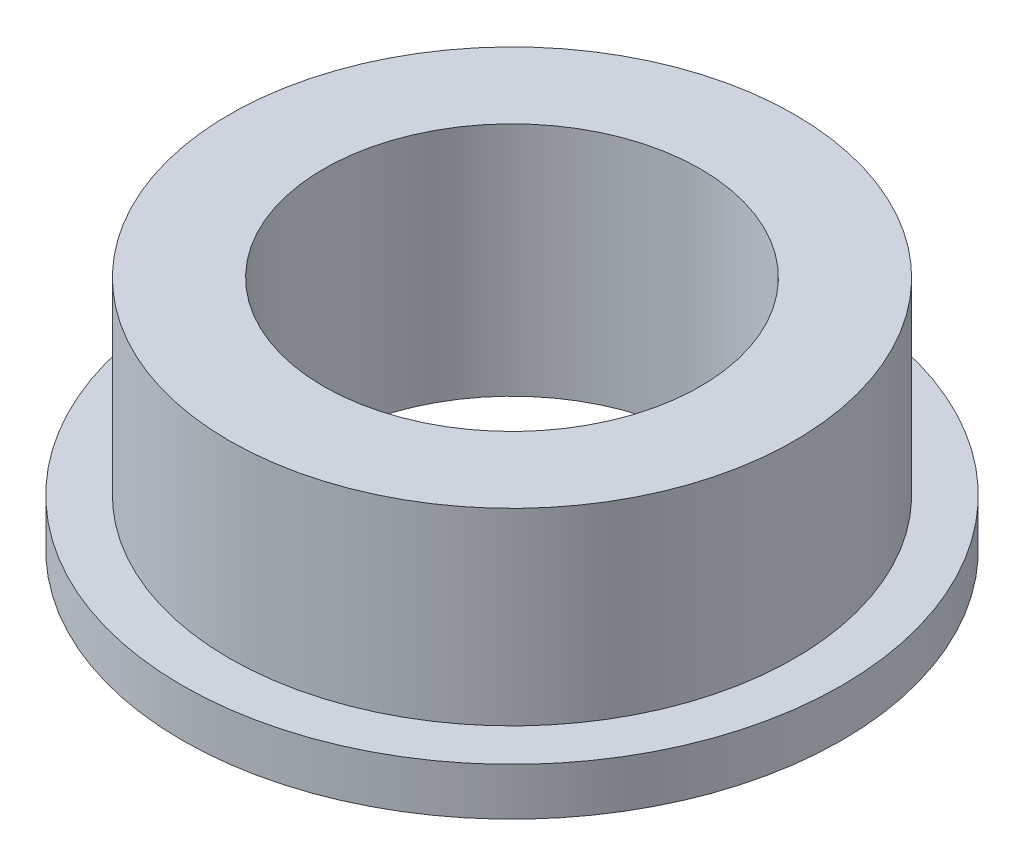
from build123d import *

# Parameters (mm, degrees)
SKETCH1_R           = 11.1125
SKETCH1_R_2         = 6.35
BOSS_EXTRUDE1_DEPTH = 1.6002
SKETCH2_R           = 9.525
SKETCH2_R_2         = 6.35
BOSS_EXTRUDE2_DEPTH = 6.35


with BuildPart() as part:
    # Sketch1 → Boss-Extrude1 (new body)
    with BuildSketch(Plane(origin=(0, 0, 0), x_dir=(1, 0, 0), z_dir=(0, 1, 0))):
        with Locations(Location((0, 0, 0), (0, 0, 270))):
            Circle(SKETCH1_R)
        with Locations(Location((0, 0, 0), (0, 0, 270))):
            Circle(SKETCH1_R_2, mode=Mode.SUBTRACT)
    extrude(amount=BOSS_EXTRUDE1_DEPTH)

    # Sketch2 → Boss-Extrude2 (add)
    with BuildSketch(Plane(origin=(0, 1.6002, 0), x_dir=(1, 0, 0), z_dir=(0, 1, 0))):
        with Locations(Location((0, 0, 0), (0, 0, 270))):
            Circle(SKETCH2_R)
        with Locations(Location((0, 0, 0), (0, 0, 270))):
            Circle(SKETCH2_R_2, mode=Mode.SUBTRACT)
    extrude(amount=BOSS_EXTRUDE2_DEPTH)


solid = part.part
